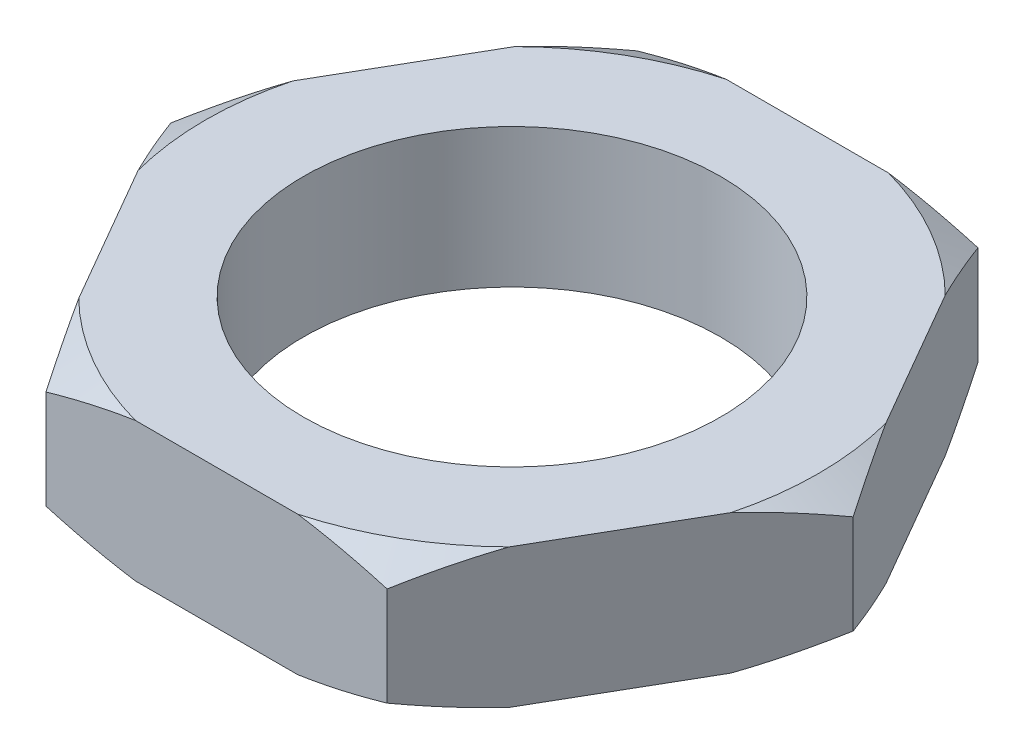
from build123d import *

# Parameters (mm, degrees)
SKETCH1_R           = 6
BOSS_EXTRUDE1_DEPTH = 4


with BuildPart() as part:
    # Sketch1 → Boss-Extrude1 (new body)
    with BuildSketch(Plane(origin=(0, 0, 0), x_dir=(1, 0, 0), z_dir=(0, 1, 0))):
        Polygon((9.814954576, 0), (4.907477288, 8.5), (-4.907477288, 8.5), (-9.814954576, 0), (-4.907477288, -8.5), (4.907477288, -8.5), align=None)
        with Locations(Location((0, 0, 0), (0, 0, 270))):
            Circle(SKETCH1_R, mode=Mode.SUBTRACT)
    extrude(amount=BOSS_EXTRUDE1_DEPTH)

    # Sketch2 → Cut-Revolve1 (revolve, cut)
    with BuildSketch(Plane.XY):
        Polygon((-9.814954576, 3.422649731), (-8.814954576, 4), (-9.814954576, 4), align=None)
        Polygon((-9.814954576, 0), (-9.814954576, 0.577350269), (-8.814954576, 0), align=None)
    revolve(axis=Axis((0, 0, 0), (0, 1, 0)), mode=Mode.SUBTRACT)


solid = part.part
